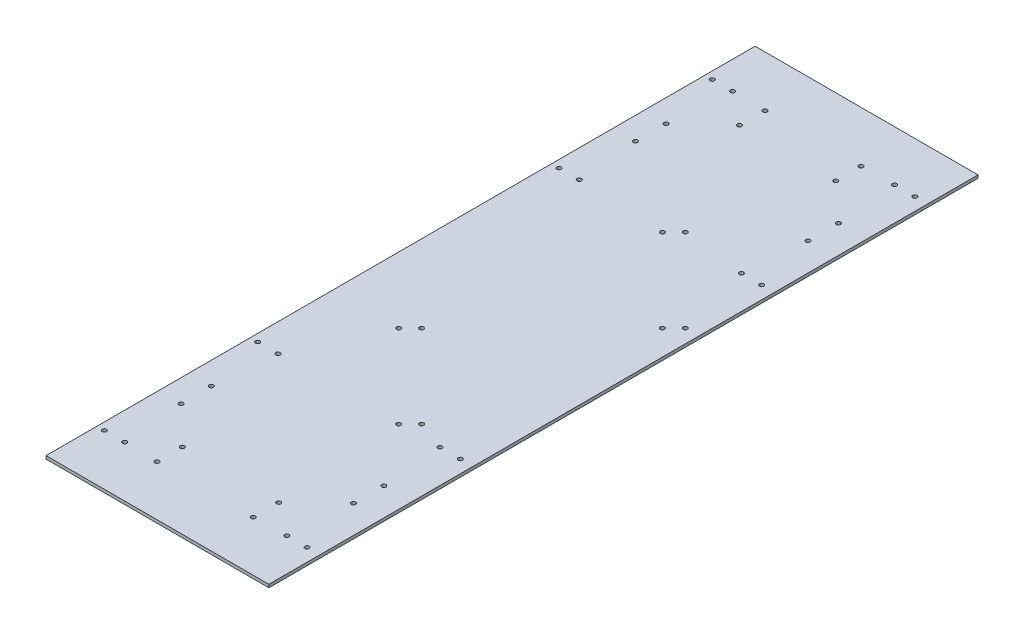
from build123d import *

# Parameters (mm, degrees)
SKETCH1_W           = 220
SKETCH1_H           = 700
BOSS_EXTRUDE1_DEPTH = 3
SKETCH2_R           = 2.125
CUT_EXTRUDE1_DEPTH  = 3
SKETCH3_R           = 2.125
CUT_EXTRUDE2_DEPTH  = 3
SKETCH4_R           = 2.125
CUT_EXTRUDE3_DEPTH  = 3


with BuildPart() as part:
    # Sketch1 → Boss-Extrude1 (new body)
    with BuildSketch(Plane(origin=(0, 0, 0), x_dir=(1, 0, 0), z_dir=(0, 1, 0))):
        Rectangle(SKETCH1_W, SKETCH1_H)
    extrude(amount=BOSS_EXTRUDE1_DEPTH)

    # Sketch2 → Cut-Extrude1 (cut)
    with BuildSketch(Plane(origin=(0, 3, 0), x_dir=(1, 0, 0), z_dir=(0, 1, 0))):
        with Locations(Location((44.939110174, 299.668572927, 0), (0, 0, 270))):
            Circle(SKETCH2_R)
        with Locations(Location((44.939110174, 274.668572927, 0), (0, 0, 270))):
            Circle(SKETCH2_R)
        with Locations(Location((-50.060889826, 274.668572927, 0), (0, 0, 90))):
            Circle(SKETCH2_R)
        with Locations(Location((-50.060889826, 299.668572927, 0), (0, 0, 90))):
            Circle(SKETCH2_R)
        with Locations(Location((-50.060889826, -300.331427073, 0), (0, 0, 270))):
            Circle(SKETCH2_R)
        with Locations(Location((-50.060889826, -275.331427073, 0), (0, 0, 270))):
            Circle(SKETCH2_R)
        with Locations(Location((44.939110174, -275.331427073, 0), (0, 0, 90))):
            Circle(SKETCH2_R)
        with Locations(Location((44.939110174, -300.331427073, 0), (0, 0, 90))):
            Circle(SKETCH2_R)
    extrude(amount=-CUT_EXTRUDE1_DEPTH, mode=Mode.SUBTRACT)

    # Sketch3 → Cut-Extrude2 (cut)
    with BuildSketch(Plane(origin=(0, 3, 0), x_dir=(1, 0, 0), z_dir=(0, 1, 0))):
        with Locations(Location((77.348583417, 300.331427073, 0), (0, 0, 270))):
            Circle(SKETCH3_R)
        with Locations(Location((77.348583417, 149.061427073, 0), (0, 0, 270))):
            Circle(SKETCH3_R)
        with Locations(Location((82.458583417, 239.696427073, 0), (0, 0, 270))):
            Circle(SKETCH3_R)
        with Locations(Location((82.458583417, 209.696427073, 0), (0, 0, 270))):
            Circle(SKETCH3_R)
        with Locations(Location((97.348583417, 149.061427073, 0), (0, 0, 90))):
            Circle(SKETCH3_R)
        with Locations(Location((97.348583417, 300.331427073, 0), (0, 0, 90))):
            Circle(SKETCH3_R)
        with Locations(Location((-102.651416583, 300.331427073, 0), (0, 0, 270))):
            Circle(SKETCH3_R)
        with Locations(Location((-102.651416583, 149.061427073, 0), (0, 0, 270))):
            Circle(SKETCH3_R)
        with Locations(Location((-87.761416583, 209.696427073, 0), (0, 0, 90))):
            Circle(SKETCH3_R)
        with Locations(Location((-87.761416583, 239.696427073, 0), (0, 0, 90))):
            Circle(SKETCH3_R)
        with Locations(Location((-82.651416583, 149.061427073, 0), (0, 0, 90))):
            Circle(SKETCH3_R)
        with Locations(Location((-82.651416583, 300.331427073, 0), (0, 0, 90))):
            Circle(SKETCH3_R)
        with Locations(Location((-82.651416583, -299.668572927, 0), (0, 0, 270))):
            Circle(SKETCH3_R)
        with Locations(Location((-82.651416583, -148.398572927, 0), (0, 0, 270))):
            Circle(SKETCH3_R)
        with Locations(Location((-87.761416583, -239.033572927, 0), (0, 0, 270))):
            Circle(SKETCH3_R)
        with Locations(Location((-87.761416583, -209.033572927, 0), (0, 0, 270))):
            Circle(SKETCH3_R)
        with Locations(Location((-102.651416583, -148.398572927, 0), (0, 0, 90))):
            Circle(SKETCH3_R)
        with Locations(Location((-102.651416583, -299.668572927, 0), (0, 0, 90))):
            Circle(SKETCH3_R)
        with Locations(Location((97.348583417, -299.668572927, 0), (0, 0, 270))):
            Circle(SKETCH3_R)
        with Locations(Location((97.348583417, -148.398572927, 0), (0, 0, 270))):
            Circle(SKETCH3_R)
        with Locations(Location((82.458583417, -209.033572927, 0), (0, 0, 90))):
            Circle(SKETCH3_R)
        with Locations(Location((82.458583417, -239.033572927, 0), (0, 0, 90))):
            Circle(SKETCH3_R)
        with Locations(Location((77.348583417, -148.398572927, 0), (0, 0, 90))):
            Circle(SKETCH3_R)
        with Locations(Location((77.348583417, -299.668572927, 0), (0, 0, 90))):
            Circle(SKETCH3_R)
    extrude(amount=-CUT_EXTRUDE2_DEPTH, mode=Mode.SUBTRACT)

    # Sketch4 → Cut-Extrude3 (cut)
    with BuildSketch(Plane(origin=(0, 3, 0), x_dir=(1, 0, 0), z_dir=(0, 1, 0))):
        with Locations((119.180611127, -231.007428758)):
            Circle(SKETCH4_R)
        with Locations((-126.892548726, 15.065731095)):
            Circle(SKETCH4_R)
        with Locations(Location((37.156224509, -148.98304214, 0), (0, 0, 270))):
            Circle(SKETCH4_R)
        with Locations(Location((-44.868162109, -66.958655523, 0), (0, 0, 270))):
            Circle(SKETCH4_R)
        with Locations((130.494319626, -219.693720259)):
            Circle(SKETCH4_R)
        with Locations(Location((48.469933008, -137.669333641, 0), (0, 0, 90))):
            Circle(SKETCH4_R)
        with Locations(Location((-33.55445361, -55.644947024, 0), (0, 0, 90))):
            Circle(SKETCH4_R)
        with Locations((-115.578840227, 26.379439594)):
            Circle(SKETCH4_R)
        with Locations(Location((3.215099012, 145.173378833, 0), (0, 0, 270))):
            Circle(SKETCH4_R)
        with Locations(Location((85.23948563, 63.148992216, 0), (0, 0, 270))):
            Circle(SKETCH4_R)
        with Locations((167.263872247, -18.875394402)):
            Circle(SKETCH4_R)
        with Locations((249.288258865, -100.89978102)):
            Circle(SKETCH4_R)
        with Locations(Location((96.553194129, 74.462700715, 0), (0, 0, 90))):
            Circle(SKETCH4_R)
        with Locations((178.577580746, -7.561685903)):
            Circle(SKETCH4_R)
        with Locations(Location((14.528807511, 156.487087332, 0), (0, 0, 90))):
            Circle(SKETCH4_R)
        with Locations((260.601967364, -89.586072521)):
            Circle(SKETCH4_R)
    extrude(amount=-CUT_EXTRUDE3_DEPTH, mode=Mode.SUBTRACT)


solid = part.part
